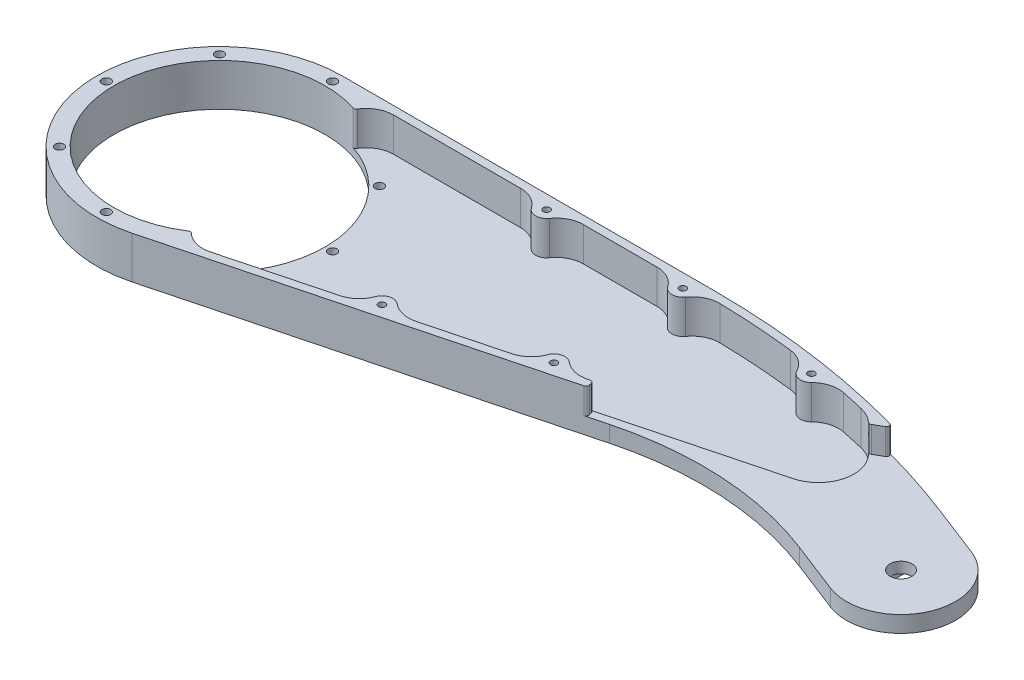
from build123d import *

# Parameters (mm, degrees)
EXTRUDE_1_DEPTH             = 9.500000000000002
EXTRUDE_2_DEPTH             = 115.05569061587602
EXTRUDE_3_DEPTH             = 5.999999999999999
CUT_EXTRUDE_1_DEPTH         = 3.000000000000001
EXTRUDE_4_DEPTH             = 12.5
EXTRUDE_5_DEPTH             = 12.5
EXTRUDE_START               = 12.5
EXTRUDE_6_DEPTH             = 12.5
EXTRUDE_7_DEPTH             = 12.5
CUT_EXTRUDE_2_DEPTH         = 2
HOLE_WIZARD_8_0_8_1_D       = 8
HOLE_WIZARD_8_0_8_1_DEPTH   = 6
HOLE_WIZARD_2_5_2_5_1_D     = 2.5
HOLE_WIZARD_3_2_3_2_1_D     = 3.2
HOLE_WIZARD_3_2_3_2_1_DEPTH = 15.5
HOLE_WIZARD_3_2_3_2_2_D     = 3.2
FILLET_1_R                  = 1
FILLET_2_R                  = 2
FILLET_3_R                  = 120.00000000000003


with BuildPart() as part:
    # Эскиз1 → Бобышка-Вытянуть1 (new body)
    with BuildSketch(Plane.XZ):
        with BuildLine():
            Line((31.779364408196322, 35.09465055833703), (32.53928446481828, 37.996808635931096))
            Line((32.53928446481828, 37.996808635931096), (11.398800849455474, 43.53237116439277))
            ThreePointArc((11.398800849455474, 43.53237116439277), (-44.6315846816897, 5.746446623885336), (0, -45))
            Line((0, -45), (136.6047385645944, -45))
            ThreePointArc((136.6047385645944, -45), (174.0514558866368, -42.49971682694584), (210.833370462018, -35.04325558103525))
            ThreePointArc((210.833370462018, -35.04325558103525), (211.56166337980483, -34.20622038377409), (211.068983168903, -33.2120852293116))
            Line((211.068983168903, -33.2120852293116), (207.14834257891937, -30.95366812818016))
            ThreePointArc((207.14834257891937, -30.95366812818016), (204.26320644859996, -33.162341546064276), (200.87949883001698, -34.4862643192222))
            ThreePointArc((200.87949883001698, -34.4862643192222), (171.45991408687433, -39.811616665453215), (141.6391276395998, -41.95452117487615))
            ThreePointArc((141.6391276395998, -41.95452117487615), (136.9266537788762, -40.870335373727656), (133.2738484900434, -37.7017580492345))
            ThreePointArc((133.2738484900434, -37.7017580492345), (129.99235706441334, -36.0000073018108), (126.71739277340599, -37.7142857142829))
            ThreePointArc((126.71739277340599, -37.7142857142829), (123.13997520578543, -40.86405260427835), (118.5108747069212, -42))
            Line((118.5108747069212, -42), (21.853203426500148, -42))
            ThreePointArc((21.853203426500148, -42), (16.621968089397427, -40.52256867662841), (12.936490941687484, -36.52683536956956))
            ThreePointArc((12.936490941687484, -36.52683536956956), (38.432753475903155, -4.948329037205795), (21.767072161661147, 32.05865046300353))
            ThreePointArc((21.767072161661147, 32.05865046300353), (26.34449721336863, 34.99051102645374), (31.779364408196322, 35.09465055833703))
        make_face()
    extrude(amount=-EXTRUDE_1_DEPTH)

    # Эскиз2 → Бобышка-Вытянуть2 (add)
    with BuildSketch(Plane(origin=(21.140483615362722, 0, -5.535562528461676), x_dir=(-0.2533066855420127, 0, -0.967386025875772), z_dir=(0.9673860258757722, 0, -0.2533066855420127))):
        Polygon((-42.00000000000173, 0), (-45.000000000001705, -8.7e-16), (-45.000000000001705, 9.5), (-42.00000000000173, 9.5), align=None)
    extrude(amount=EXTRUDE_2_DEPTH)

    # Эскиз3 → Бобышка-Вытянуть3 (add)
    with BuildSketch(Plane(origin=(0, 9.500000000000002, 0), x_dir=(-1, 0, 0), z_dir=(0, 1, 0))):
        with BuildLine():
            Line((0, -45), (-136.6047385645944, -45))
            ThreePointArc((-136.6047385645944, -45), (-188.48995572376379, -40.179977983128), (-238.599420052963, -25.88487544631455))
            Line((-238.599420052963, -25.88487544631455), (-257.242147749639, -18.6427276966758))
            ThreePointArc((-257.242147749639, -18.6427276966758), (-268.6427276966758, 7.242147749639007), (-242.757852250361, 18.6427276966758))
            Line((-242.757852250361, 18.6427276966758), (-187.87549846851005, -2.677441830178293))
            Line((-187.87549846851005, -2.677441830178293), (-11.398800849390101, 43.53237116440985))
            ThreePointArc((-11.398800849390101, 43.53237116440985), (44.63158468169398, 5.74644662385182), (0, -45))
        make_face()
    extrude(amount=EXTRUDE_3_DEPTH)

    # Эскиз4 → Вырез-Вытянуть1 (cut)
    with BuildSketch(Plane.XZ.offset(-9.500000000000002)):
        with BuildLine():
            Line((201.174054751897, -9.26076332158908), (31.779364408181, 35.094650558340646))
            ThreePointArc((31.779364408181, 35.094650558340646), (26.344497213361088, 34.99051102645149), (21.767072161661147, 32.05865046300353))
            ThreePointArc((21.767072161661147, 32.05865046300353), (38.432753475903155, -4.9483290372057915), (12.936490941687483, -36.526835369569554))
            ThreePointArc((12.936490941687483, -36.526835369569554), (16.621968089397427, -40.52256867662841), (21.853203426500148, -42))
            Line((21.853203426500148, -42), (118.5108747069212, -42))
            ThreePointArc((118.5108747069212, -42), (123.13997520578546, -40.8640526042784), (126.71739277340599, -37.7142857142829))
            ThreePointArc((126.71739277340599, -37.7142857142829), (129.99235706441334, -36.00000730181071), (133.2738484900434, -37.7017580492345))
            ThreePointArc((133.2738484900434, -37.7017580492345), (136.92665377887585, -40.870335373728324), (141.6391276395998, -41.95452117487615))
            ThreePointArc((141.6391276395998, -41.95452117487615), (171.4599140868743, -39.8116166654531), (200.87949883001698, -34.4862643192222))
            ThreePointArc((200.87949883001698, -34.4862643192222), (210.88018165389494, -21.98857114883415), (201.174054751897, -9.26076332158908))
        make_face()
    extrude(amount=-CUT_EXTRUDE_1_DEPTH, mode=Mode.SUBTRACT)

    # Эскиз5 → Бобышка-Вытянуть4 (add)
    with BuildSketch(Plane.XZ.offset(-12.500000000000002)):
        with BuildLine():
            Line((69.39219411302629, 25.245861169673617), (91.62103262914168, 19.425316674141865))
            ThreePointArc((91.62103262914168, 19.425316674141865), (86.85516242440718, 19.49899914179931), (82.59656164963481, 17.358142454506996))
            ThreePointArc((82.59656164963481, 17.358142454506996), (78.98677325783201, 16.531272766653025), (76.24546493074466, 19.02115516751604))
            ThreePointArc((76.24546493074466, 19.02115516751604), (73.58257817824061, 22.974379428515537), (69.39219411302629, 25.245861169673617))
        make_face()
    extrude(amount=EXTRUDE_4_DEPTH)

    # Эскиз6 → Бобышка-Вытянуть5 (add)
    with BuildSketch(Plane.XZ.offset(-12.500000000000002)):
        with BuildLine():
            Line((119.39219411302322, 12.153534075498996), (141.6210326291386, 6.332989579967239))
            ThreePointArc((141.6210326291386, 6.332989579967239), (136.8551624244041, 6.406672047624693), (132.59656164963178, 4.26581536033236))
            ThreePointArc((132.59656164963178, 4.26581536033236), (128.986773257829, 3.438945672478428), (126.24546493074165, 5.928828073341451))
            ThreePointArc((126.24546493074165, 5.928828073341451), (123.58257817823758, 9.882052334340969), (119.39219411302322, 12.153534075498996))
        make_face()
    extrude(amount=EXTRUDE_5_DEPTH)

    # Эскиз7 → Бобышка-Вытянуть6 (add)
    with BuildSketch(Plane.XZ.offset(-12.500000000000002).offset(EXTRUDE_START)):
        with BuildLine():
            ThreePointArc((169.350540410565, -40.06937238400199), (173.90141926099287, -38.33703307937142), (177.09458850993005, -34.660734951460455))
            ThreePointArc((177.09458850993005, -34.660734951460455), (180.02526915777943, -32.52060975329769), (183.4802160115175, -33.63073008971875))
            ThreePointArc((183.4802160115175, -33.63073008971875), (187.66734322037206, -36.11658276325075), (192.5321018049815, -36.33017511120823))
            ThreePointArc((192.5321018049815, -36.33017511120823), (180.98072250488946, -38.44404700724877), (169.350540410565, -40.06937238400199))
        make_face()
    extrude(amount=-EXTRUDE_6_DEPTH)

    # Эскиз8 → Бобышка-Вытянуть7 (add)
    with BuildSketch(Plane.XZ.offset(-12.500000000000002)):
        with BuildLine():
            Line((91.489125293076, -42), (68.510874706924, -42))
            ThreePointArc((68.510874706924, -42), (73.13997520578674, -40.86405260427919), (76.71739277340684, -37.714285714285715))
            ThreePointArc((76.71739277340684, -37.714285714285715), (80.00000000000003, -36), (83.2826072265932, -37.714285714285765))
            ThreePointArc((83.2826072265932, -37.714285714285765), (86.86002479421332, -40.86405260427916), (91.489125293076, -42))
        make_face()
    extrude(amount=EXTRUDE_7_DEPTH)

    # Эскиз9 → Вырез-Вытянуть2 (cut)
    with BuildSketch(Plane(origin=(0, 15.5, 0), x_dir=(-1, 0, 0), z_dir=(0, 1, 0))):
        with BuildLine():
            Line((-245.75, -6.777720855862977), (-245.75, 6.777720855862977))
            ThreePointArc((-245.75, 6.777720855862977), (-249.99999999999997, 7.999999999999998), (-254.24999999999997, 6.777720855862994))
            Line((-254.24999999999997, 6.777720855862994), (-254.24999999999997, -6.777720855862994))
            ThreePointArc((-254.24999999999997, -6.777720855862994), (-249.99999999999997, -7.999999999999997), (-245.75, -6.777720855862977))
        make_face()
    extrude(amount=-CUT_EXTRUDE_2_DEPTH, mode=Mode.SUBTRACT)

    # Эскиз10 → Вырез-Повернуть1 (revolve, cut)
    with BuildSketch(Plane(origin=(0, 0, 0), x_dir=(-1, 0, 0), z_dir=(0, 0, -1)), mode=Mode.PRIVATE) as cut_revolve_1_sk:
        Polygon((-38.75000000000001, 0), (0, 0), (0, 15.5), (-38.75, 15.5), align=None)
    revolve(cut_revolve_1_sk.sketch.rotate(Axis((0, 0, 0), (0, 1, 0)), 270), axis=Axis((0, 0, 0), (0, 1, 0)), mode=Mode.SUBTRACT)

    # Диаметр отверстия Ø8.0 (8)1
    with Locations(Plane(origin=(0, 9.500000000000002, 0), x_dir=(-1, 0, 0), z_dir=(0, -1, 0))):
        with Locations((-250, 0)):
            Hole(HOLE_WIZARD_8_0_8_1_D / 2, depth=HOLE_WIZARD_8_0_8_1_DEPTH)

    # Диаметр отверстия Ø2.5 (2.5)1 (through all)
    with Locations(Plane(origin=(0, 15.5, 0), x_dir=(1, 0, 0), z_dir=(0, 1, 0))):
        with Locations((130, -7.308489776), (130, 40), (80, -20.40081687), (180.662238056, 36.469567923), (80, 40)):
            Hole(HOLE_WIZARD_2_5_2_5_1_D / 2)

    # Диаметр отверстия Ø3.2 (3.2)1
    with Locations(Plane(origin=(0, 15.5, 0), x_dir=(1, 0, 0), z_dir=(0, 1, 0))):
        with Locations((29.344931419, 29.344931419), (41.5, 0), (29.344931419, -29.344931419)):
            Hole(HOLE_WIZARD_3_2_3_2_1_D / 2, depth=HOLE_WIZARD_3_2_3_2_1_DEPTH)

    # Диаметр отверстия Ø3.2 (3.2)2 (through all)
    with Locations(Plane(origin=(0, 15.5, 0), x_dir=(1, 0, 0), z_dir=(0, 1, 0))):
        with Locations((-29.344931419, 29.344931419), (0, 41.5), (0, -41.5), (-29.344931419, -29.344931419), (-41.5, 0)):
            Hole(HOLE_WIZARD_3_2_3_2_2_D / 2)

    # Скругление1
    fillet_1_edges = [part.edges().sort_by_distance(p)[0] for p in [
        (21.767072161661147, 6.250000000000002, 32.05865046300353),
        (12.936490941687481, 6.250000000000002, -36.526835369569554),
        (207.14834257891937, 4.750000000000001, -30.953668128180162),
        (143.08263170741236, 4.75, 5.95027491566762),
        (143.84255176403838, 4.749999999999999, 8.852432993294912),
    ]]
    fillet(fillet_1_edges, radius=FILLET_1_R)

    # Скругление2
    fillet_2_edges = [part.edges().sort_by_distance(p)[0] for p in [
        (245.75, 14.5, -6.777720855862977),
        (254.24999999999997, 14.5, -6.777720855862994),
        (254.24999999999997, 14.5, 6.777720855862995),
        (245.75, 14.5, 6.7777208558629765),
    ]]
    fillet(fillet_2_edges, radius=FILLET_2_R)

    # Скругление3
    fillet_3_edges = [part.edges().sort_by_distance(p)[0] for p in [
        (187.87549846851005, 12.500000000000002, -2.677441830178293),
    ]]
    fillet(fillet_3_edges, radius=FILLET_3_R)


with BuildPart() as body_2:
    # Зеркальное отражение1: mirrored copy
    add(part.part.mirror(Plane(origin=(0, 15.5, 0), x_dir=(0, 0, 1), z_dir=(0, -1, 0))))


solid = body_2.part
